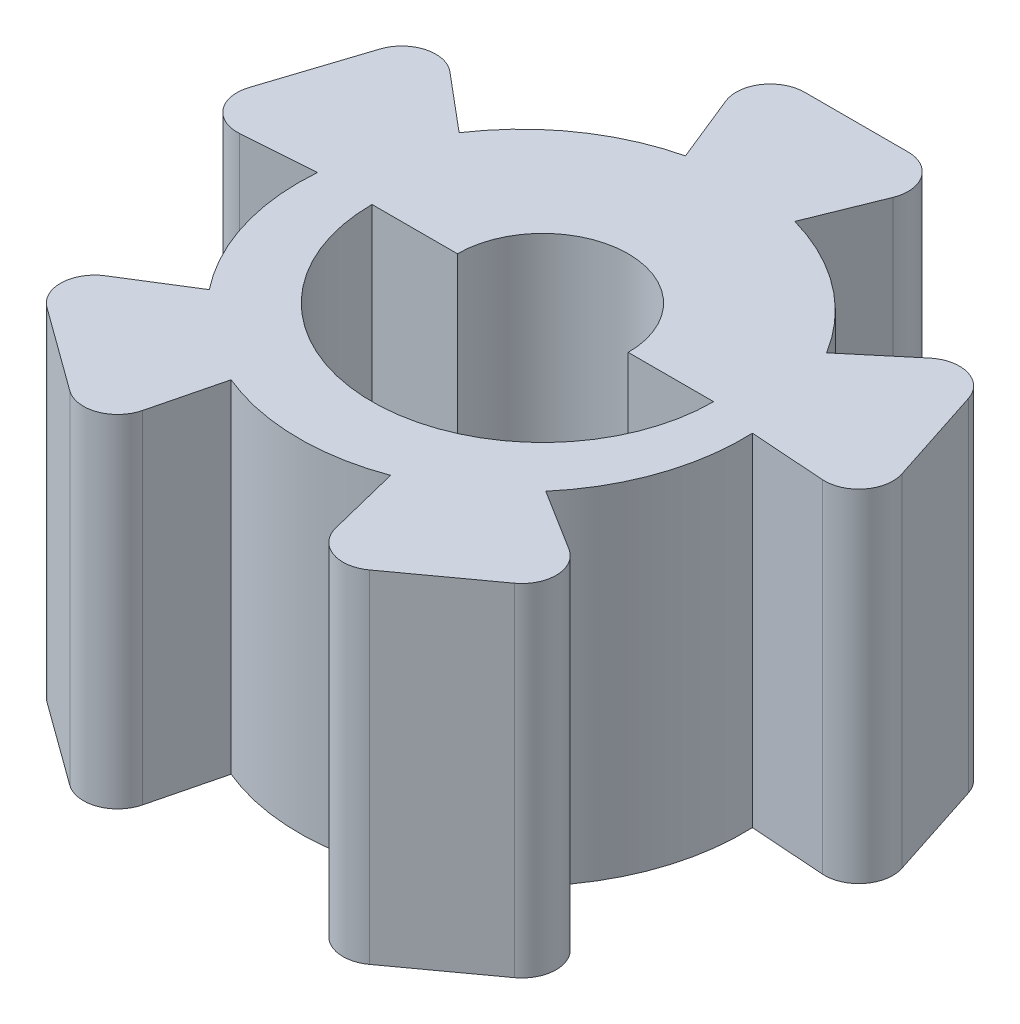
from build123d import *

# Parameters (mm, degrees)
BOSS_EXTRUDE1_DEPTH = 5
CUT_EXTRUDE1_DEPTH  = 10
FILLET1_R           = 0.5


with BuildPart() as part:
    # Sketch1 → Boss-Extrude1 (new body)
    with BuildSketch(Plane(origin=(0, 0, 0), x_dir=(1, 0, 0), z_dir=(0, 1, 0))):
        with BuildLine():
            Line((-1.5, 4.588107716), (-0.821593865, 2.908993609))
            ThreePointArc((-0.821593865, 2.908993609), (-1.925604645, 2.412618737), (-2.771400023, 1.546675324))
            Line((-2.771400023, 1.546675324), (-4.18358485, 2.731639091))
            Line((-4.18358485, 2.731639091), (-5.110635833, -0.121530457))
            Line((-5.110635833, -0.121530457), (-3.304064395, 0.004797324))
            ThreePointArc((-3.304064395, 0.004797324), (-3.173141931, -1.198567594), (-2.610945952, -2.27055803))
            Line((-2.610945952, -2.27055803), (-4.174302575, -3.24745167))
            Line((-4.174302575, -3.24745167), (-1.747251592, -5.010807427))
            Line((-1.747251592, -5.010807427), (-1.309135176, -3.253618458))
            ThreePointArc((-1.309135176, -3.253618458), (-0.124209863, -3.500964005), (1.069041739, -3.297547119))
            Line((1.069041739, -3.297547119), (1.515019036, -5.086264359))
            Line((1.515019036, -5.086264359), (3.942070019, -3.322908602))
            Line((3.942070019, -3.322908602), (2.406269417, -2.363233875))
            ThreePointArc((2.406269417, -2.363233875), (3.007671071, -1.312736913), (3.182945139, -0.115027927))
            Line((3.182945139, -0.115027927), (5.02193089, -0.243622337))
            Line((5.02193089, -0.243622337), (4.094879907, 2.609547212))
            Line((4.094879907, 2.609547212), (2.707586519, 1.445469841))
            ThreePointArc((2.707586519, 1.445469841), (1.894347869, 2.342058217), (0.809421598, 2.878866192))
            Line((0.809421598, 2.878866192), (1.5, 4.588107716))
            Line((1.5, 4.588107716), (-1.5, 4.588107716))
        make_face()
    extrude(amount=BOSS_EXTRUDE1_DEPTH)

    # Sketch2 → Cut-Extrude1 (cut)
    with BuildSketch(Plane(origin=(0, 5, 0), x_dir=(1, 0, 0), z_dir=(0, 1, 0))):
        with BuildLine():
            Line((-1.25, 0), (-2.5, 0))
            ThreePointArc((-2.5, 0), (0, -2.5), (2.5, 0))
            Line((2.5, 0), (1.25, 0))
            ThreePointArc((1.25, 0), (0, 1.25), (-1.25, 0))
        make_face()
    extrude(amount=-CUT_EXTRUDE1_DEPTH, mode=Mode.SUBTRACT)

    # Fillet1
    fillet1_edges = [part.edges().sort_by_distance(p)[0] for p in [
        (3.942070019, 2.5, 3.322908602),
        (1.515019036, 2.5, 5.086264359),
        (-1.747251592, 2.5, 5.010807427),
        (-4.174302575, 2.5, 3.24745167),
        (-5.110635833, 2.5, 0.121530457),
        (-4.18358485, 2.5, -2.731639091),
        (-1.5, 2.5, -4.588107716),
        (1.5, 2.5, -4.588107716),
        (4.094879907, 2.5, -2.609547212),
        (5.02193089, 2.5, 0.243622337),
    ]]
    fillet(fillet1_edges, radius=FILLET1_R)


solid = part.part
